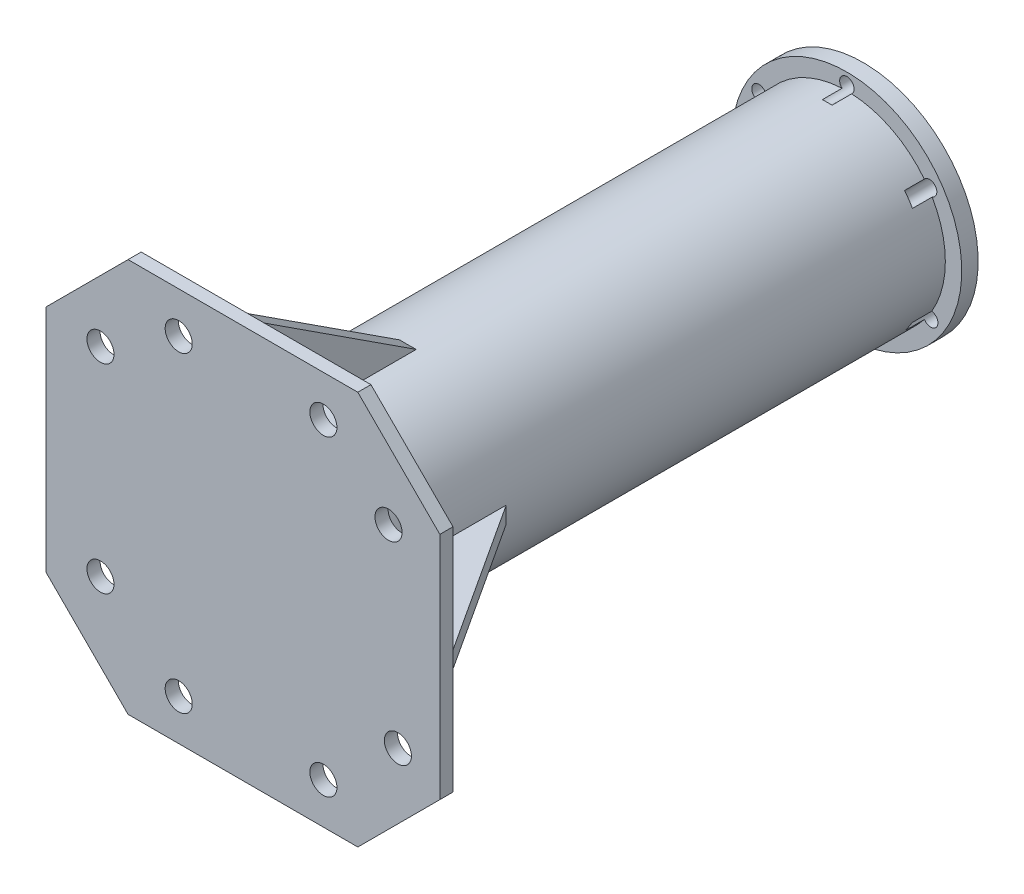
from build123d import *

# Parameters (mm, degrees)
SKETCH2_R               = 60
BOSS_EXTRUDE1_DEPTH     = 360
SKETCH3_R               = 70
BOSS_EXTRUDE2_DEPTH     = 10
BOSS_EXTRUDE4_DEPTH     = 8
BOSS_EXTRUDE5_DEPTH     = 5
CIRPATTERN1_COUNT       = 4
SKETCH5_R               = 8.25
CUT_EXTRUDE2_DEPTH      = 10
SKETCH8_R               = 8.25
CUT_EXTRUDE3_DEPTH      = 10
CUT_EXTRUDE8_DEPTH      = 25
CUT_EXTRUDE8_DEPTH_BACK = 22
SKETCH9_R               = 4.4


with BuildPart() as part:
    # Sketch2 → Boss-Extrude1 (new body)
    with BuildSketch(Plane.XY):
        Circle(SKETCH2_R)
    extrude(amount=BOSS_EXTRUDE1_DEPTH)

    # Sketch3 → Boss-Extrude2 (add)
    with BuildSketch(Plane(origin=(0, 0, 0), x_dir=(-1, 0, 0), z_dir=(0, 0, -1))):
        Circle(SKETCH3_R)
    extrude(amount=BOSS_EXTRUDE2_DEPTH)

    # Sketch4 → Boss-Extrude4 (add)
    with BuildSketch(Plane.XY.offset(360)):
        Polygon((-70, 120), (-120, 70), (-120, -70), (-70, -120), (70, -120), (120, -70), (120, 70), (70, 120), align=None)
    extrude(amount=BOSS_EXTRUDE4_DEPTH)

    # Sketch7 → Boss-Extrude5 (add, symmetric)
    with BuildSketch(Plane(origin=(0, 0, 0), x_dir=(0, 0, -1), z_dir=(1, 0, 0))):
        Polygon((-360, -120), (-260, -55), (-360, -55), align=None)
    boss_extrude5 = extrude(amount=BOSS_EXTRUDE5_DEPTH, both=True)

    # CirPattern1: Boss-Extrude5 ×4 about axis
    cirpattern1_axis = Axis((0, 0, 0), (0, 0, 1))
    for i in range(1, CIRPATTERN1_COUNT):
        add(boss_extrude5.rotate(cirpattern1_axis, i * 360 / CIRPATTERN1_COUNT))

    # Sketch5 → Cut-Extrude2 (cut)
    with BuildSketch(Plane.XY.offset(368)):
        with Locations((-39.145715053, 95)):
            Circle(SKETCH5_R)
        with Locations((-39.145715053, -95)):
            Circle(SKETCH5_R)
        with Locations((49.020413154, 95)):
            Circle(SKETCH5_R)
        with Locations((49.020413154, -95)):
            Circle(SKETCH5_R)
    extrude(amount=-CUT_EXTRUDE2_DEPTH, mode=Mode.SUBTRACT)

    # Sketch8 → Cut-Extrude3 (cut)
    with BuildSketch(Plane.XY.offset(368)):
        with Locations((-86.808078285, 65.641177005)):
            Circle(SKETCH8_R)
        with Locations((-86.808078285, -55.652302243)):
            Circle(SKETCH8_R)
        with Locations((94.418649532, -55.652302243)):
            Circle(SKETCH8_R)
        with Locations((88.710721097, 59.457587867)):
            Circle(SKETCH8_R)
    extrude(amount=-CUT_EXTRUDE3_DEPTH, mode=Mode.SUBTRACT)

    # Sketch9 → Cut-Extrude8 (cut, two sides: drawn at the far end of the back side and taken through both)
    with BuildSketch(Plane(origin=(0, 0, -10), x_dir=(-1, 0, 0), z_dir=(0, 0, -1)).offset(-CUT_EXTRUDE8_DEPTH_BACK)):
        with Locations(Location((0, 63.204671138, 0), (0, 0, 228.131406789))):
            Circle(SKETCH9_R)
        with Locations((1.290982991, -53.670475155)):
            Circle(SKETCH9_R)
        with Locations(Location((53.562270393, 32.283588378, 0), (0, 0, 157.987594356))):
            Circle(SKETCH9_R)
        with Locations(Location((-50.426550115, 34.101651925, 0), (0, 0, 249.437866914))):
            Circle(SKETCH9_R)
        with Locations(Location((52.769279557, -32.934214303, 0), (0, 0, 206.210166052))):
            Circle(SKETCH9_R)
        with Locations(Location((-51.084491131, -34.716860238, 0), (0, 0, 98.670706964))):
            Circle(SKETCH9_R)
    extrude(amount=CUT_EXTRUDE8_DEPTH + CUT_EXTRUDE8_DEPTH_BACK, mode=Mode.SUBTRACT)


solid = part.part
